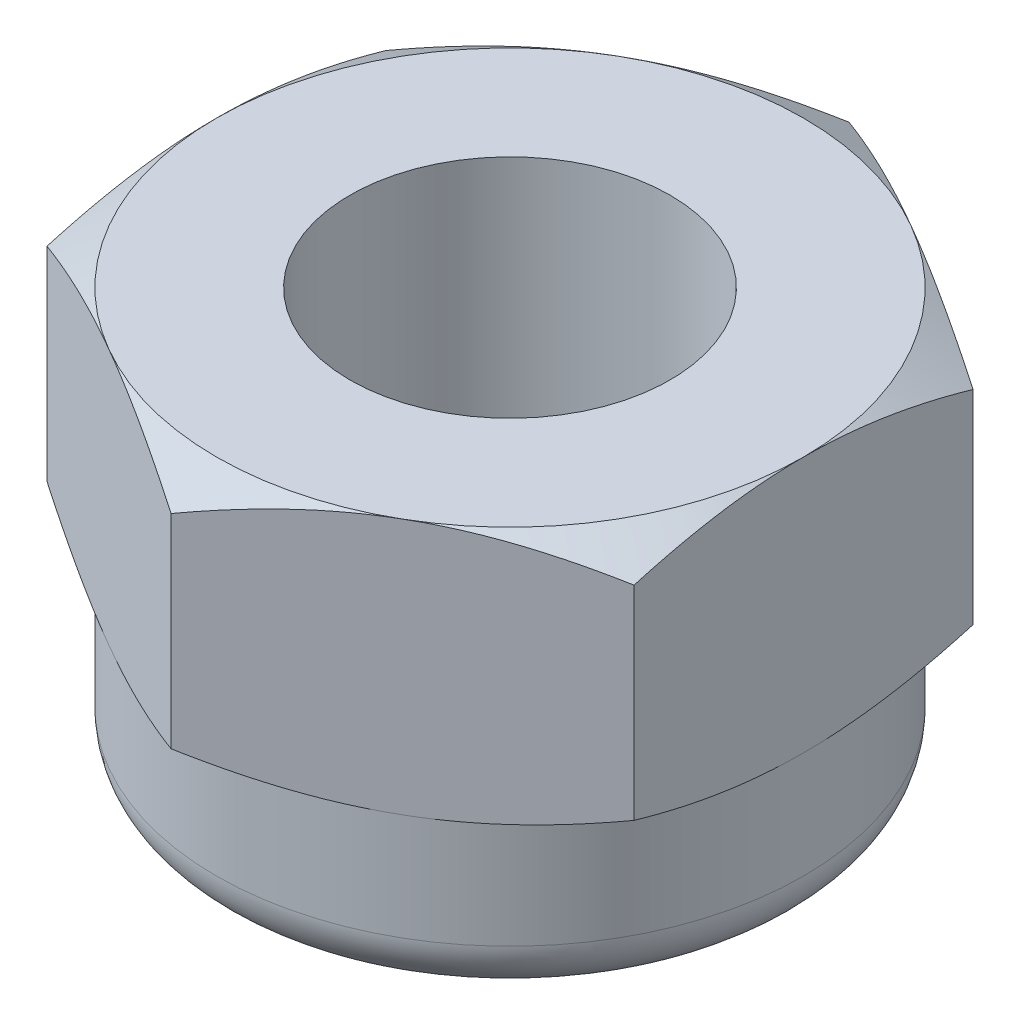
from build123d import *
from build123d.topology import SkipClean

# Parameters (mm, degrees)
SKETCH_1_R      = 1.5
EXTRUDE_2_DEPTH = 2.4
EXTRUDE_START   = 1.5
SKETCH_3_R      = 2.75
SKETCH_3_R_2    = 1.5
EXTRUDE_3_DEPTH = 1.5
FILLET_1_R      = 0.5


with BuildPart() as part:
    # 草图1 → 凸台-拉伸2 (new body)
    with BuildSketch(Plane(origin=(0, 0, 0), x_dir=(1, 0, 0), z_dir=(0, 1, 0))):
        Polygon((2.75, 1.58771324), (0, 3.175426481), (-2.75, 1.58771324), (-2.75, -1.58771324), (0, -3.175426481), (2.75, -1.58771324), align=None)
        with Locations(Location((0, 0, 0), (0, 0, 270))):
            Circle(SKETCH_1_R, mode=Mode.SUBTRACT)
    extrude(amount=EXTRUDE_2_DEPTH)

    # 草图2 → 切除-旋转1 (revolve, cut)
    with BuildSketch(Plane.XY):
        Polygon((4.828460969, 1.2), (2.75, 2.4), (4.828460969, 2.4), align=None)
        Polygon((2.75, 0), (4.828460969, 1.2), (4.828460969, 0), align=None)
    revolve(axis=Axis((0, 1.981363764, 0), (0, 1, 0)), mode=Mode.SUBTRACT)

    # 草图3 → 凸台-拉伸3 (add)
    with SkipClean():  # the faces are left unmerged after this step: merging them gives an invalid solid
        with BuildSketch(Plane.XZ.offset(EXTRUDE_START)):
            with Locations(Location((0, 0, 0), (0, 0, 60))):
                Circle(SKETCH_3_R)
            with Locations(Location((0, 0, 0), (0, 0, 270))):
                Circle(SKETCH_3_R_2, mode=Mode.SUBTRACT)
        extrude(amount=-EXTRUDE_3_DEPTH)

    # 圆角1
    fillet_1_edges = [part.edges().sort_by_distance(p)[0] for p in [
        (-1.375, -1.5, -2.38156986),
    ]]
    fillet(fillet_1_edges, radius=FILLET_1_R)


solid = part.part
